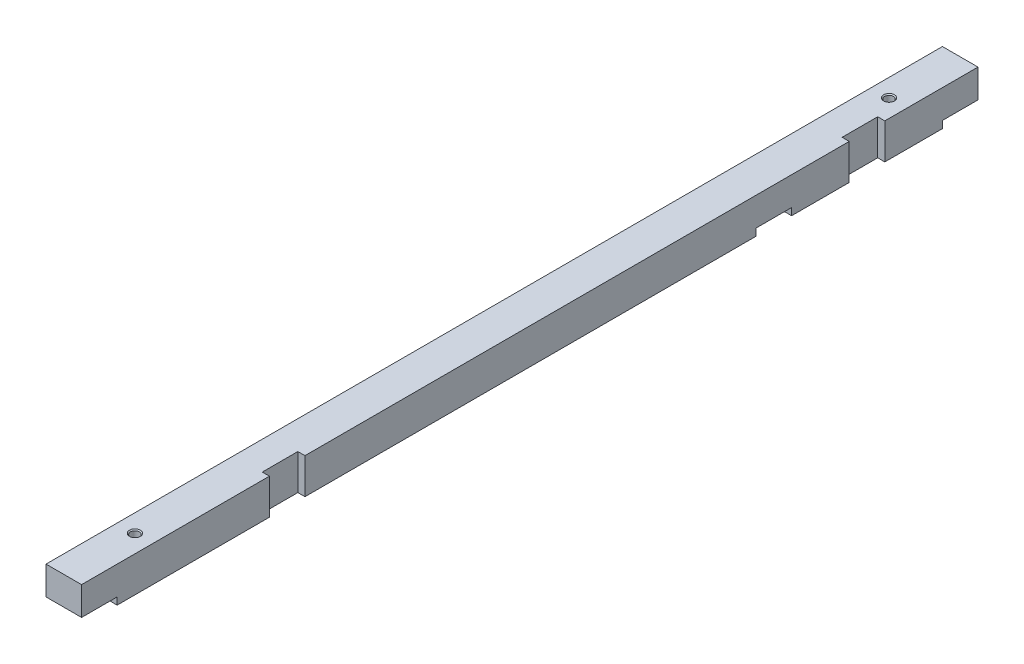
from build123d import *

# Parameters (mm, degrees)
ESQUISSE1_W                     = 10
ESQUISSE1_H                     = 10
BOSS_EXTRU_1_DEPTH              = 252
ESQUISSE2_W                     = 10
ESQUISSE2_H                     = 2
ENL_V_MAT_EXTRU_1_DEPTH         = 253.247893946
ESQUISSE3_W                     = 231
ESQUISSE3_H                     = 10
ENL_V_MAT_EXTRU_2_DEPTH         = 253.247893946
ESQUISSE4_W                     = 231
ESQUISSE4_H                     = 10
ENL_V_MAT_EXTRU_3_DEPTH         = 253.247893946
TROU_TARAUD_M3X0_51_D           = 2.5
TROU_TARAUD_M3X0_51_CSINK_D     = 3.05
TROU_TARAUD_M3X0_51_CSINK_ANGLE = 90


with BuildPart() as part:
    # Esquisse1 → Boss.-Extru.1 (new body)
    with BuildSketch(Plane.XY):
        Rectangle(ESQUISSE1_W, ESQUISSE1_H)
    extrude(amount=BOSS_EXTRU_1_DEPTH)

    # Esquisse2 → Enlèv. mat.-Extru.1 (cut, through all)
    with BuildSketch(Plane.ZY.offset(5)):
        with Locations((5, -4)):
            Rectangle(ESQUISSE2_W, ESQUISSE2_H)
        with Locations((57.4, -4)):
            Rectangle(ESQUISSE2_W, ESQUISSE2_H)
        with Locations((247, -4)):
            Rectangle(ESQUISSE2_W, ESQUISSE2_H)
    extrude(amount=-ENL_V_MAT_EXTRU_1_DEPTH, mode=Mode.SUBTRACT)

    # Esquisse3 → Enlèv. mat.-Extru.2 (cut, through all)
    with BuildSketch(Plane.XZ.offset(5)):
        with Locations((118.5, 31.2)):
            Rectangle(ESQUISSE3_W, ESQUISSE3_H)
    extrude(amount=-ENL_V_MAT_EXTRU_2_DEPTH, mode=Mode.SUBTRACT)

    # Esquisse4 → Enlèv. mat.-Extru.3 (cut, through all)
    with BuildSketch(Plane(origin=(0, 5, 0), x_dir=(1, 0, 0), z_dir=(0, 1, 0))):
        with Locations((118.5, -194.2)):
            Rectangle(ESQUISSE4_W, ESQUISSE4_H)
    extrude(amount=-ENL_V_MAT_EXTRU_3_DEPTH, mode=Mode.SUBTRACT)

    # Trou taraudé M3x0.51 (through all)
    with Locations(Plane(origin=(0, 5, 0), x_dir=(1, 0, 0), z_dir=(0, 1, 0))):
        with Locations((0, -20), (0, -232)):
            CounterSinkHole(TROU_TARAUD_M3X0_51_D / 2, TROU_TARAUD_M3X0_51_CSINK_D / 2, counter_sink_angle=TROU_TARAUD_M3X0_51_CSINK_ANGLE)


solid = part.part
